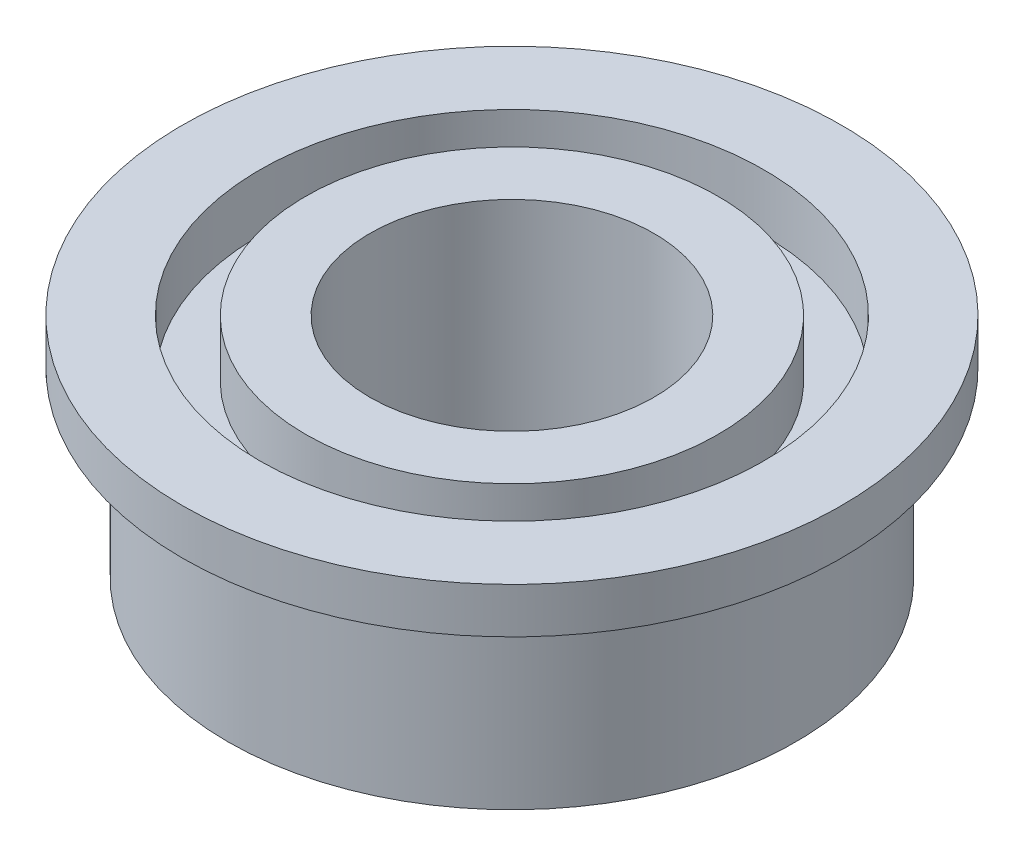
from build123d import *

# Parameters (mm, degrees)
SKETCH1_R           = 5
SKETCH1_R_2         = 2.5
BOSS_EXTRUDE1_DEPTH = 3.2
SKETCH2_R           = 5.8
SKETCH2_R_2         = 2.5
BOSS_EXTRUDE2_DEPTH = 0.8
SKETCH3_R           = 4.35508582
SKETCH3_R_2         = 3.692114727
CUT_EXTRUDE1_DEPTH  = 1
SKETCH4_R           = 4.43730614
SKETCH4_R_2         = 3.629860823
CUT_EXTRUDE2_DEPTH  = 1


with BuildPart() as part:
    # Sketch1 → Boss-Extrude1 (new body)
    with BuildSketch(Plane(origin=(0, 0, 0), x_dir=(1, 0, 0), z_dir=(0, 1, 0))):
        with Locations(Location((0, 0, 0), (0, 0, 270))):
            Circle(SKETCH1_R)
        with Locations(Location((0, 0, 0), (0, 0, 270))):
            Circle(SKETCH1_R_2, mode=Mode.SUBTRACT)
    extrude(amount=BOSS_EXTRUDE1_DEPTH)

    # Sketch2 → Boss-Extrude2 (add)
    with BuildSketch(Plane(origin=(0, 3.2, 0), x_dir=(1, 0, 0), z_dir=(0, 1, 0))):
        with Locations(Location((0, 0, 0), (0, 0, 270))):
            Circle(SKETCH2_R)
        with Locations(Location((0, 0, 0), (0, 0, 270))):
            Circle(SKETCH2_R_2, mode=Mode.SUBTRACT)
    extrude(amount=BOSS_EXTRUDE2_DEPTH)

    # Sketch3 → Cut-Extrude1 (cut)
    with BuildSketch(Plane.XZ):
        with Locations(Location((0, 0, 0), (0, 0, 270))):
            Circle(SKETCH3_R)
        with Locations(Location((0, 0, 0), (0, 0, 270))):
            Circle(SKETCH3_R_2, mode=Mode.SUBTRACT)
    extrude(amount=-CUT_EXTRUDE1_DEPTH, mode=Mode.SUBTRACT)

    # Sketch4 → Cut-Extrude2 (cut)
    with BuildSketch(Plane(origin=(0, 4, 0), x_dir=(1, 0, 0), z_dir=(0, 1, 0))):
        with Locations(Location((0, 0, 0), (0, 0, 270))):
            Circle(SKETCH4_R)
        with Locations(Location((0, 0, 0), (0, 0, 270))):
            Circle(SKETCH4_R_2, mode=Mode.SUBTRACT)
    extrude(amount=-CUT_EXTRUDE2_DEPTH, mode=Mode.SUBTRACT)


solid = part.part
